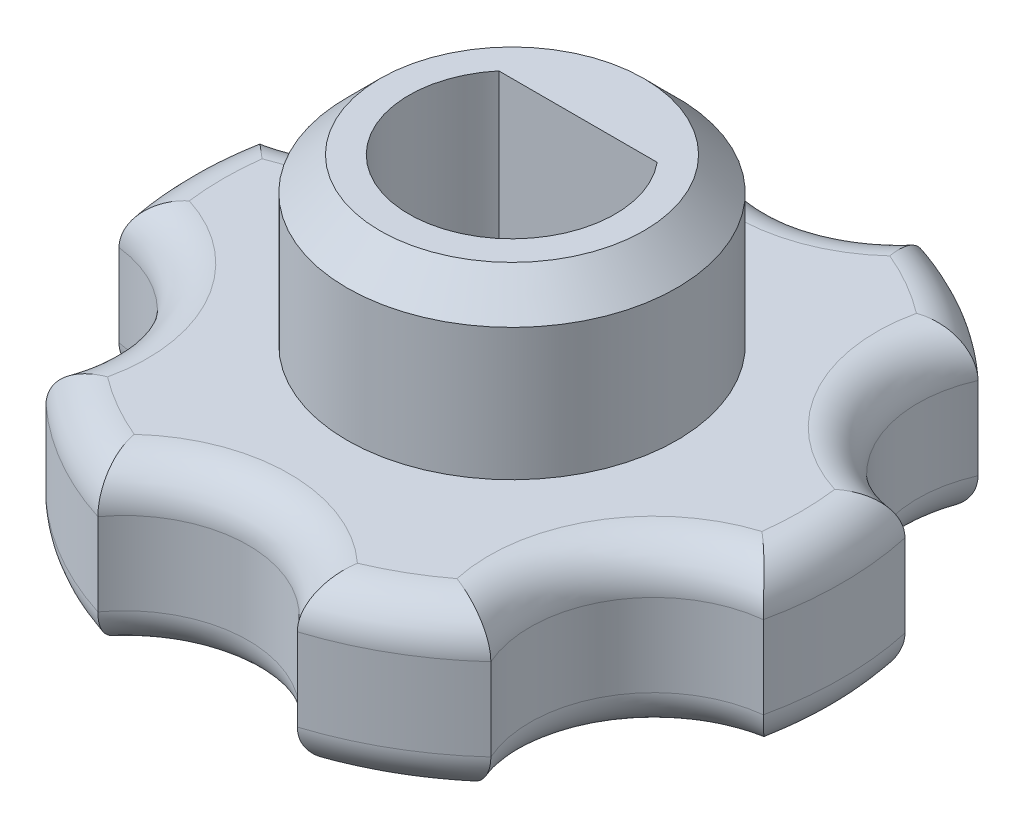
from build123d import *

# Parameters (mm, degrees)
BOSS_EXTRUDE1_DEPTH = 20
SKETCH4_R           = 20
BOSS_EXTRUDE2_DEPTH = 20
CUT_EXTRUDE1_DEPTH  = 20
FILLET1_R           = 5
CHAMFER1_SIZE       = 4


with BuildPart() as part:
    # Sketch3 → Boss-Extrude1 (new body)
    with BuildSketch(Plane(origin=(0, 0, 0), x_dir=(1, 0, 0), z_dir=(0, 1, 0))):
        with BuildLine():
            ThreePointArc((-39.066867795, 8.589519236), (-40, 0), (-39.066867795, -8.589519236))
            ThreePointArc((-39.066867795, -8.589519236), (-27.712812921, -16), (-26.972175762, -29.538140339))
            ThreePointArc((-26.972175762, -29.538140339), (-20, -34.641016151), (-12.094692033, -38.127659574))
            ThreePointArc((-12.094692033, -38.127659574), (0, -32), (12.094692033, -38.127659574))
            ThreePointArc((12.094692033, -38.127659574), (20, -34.641016151), (26.972175762, -29.538140339))
            ThreePointArc((26.972175762, -29.538140339), (27.712812921, -16), (39.066867795, -8.589519236))
            ThreePointArc((39.066867795, -8.589519236), (40, 0), (39.066867795, 8.589519236))
            ThreePointArc((39.066867795, 8.589519236), (27.712812921, 16), (26.972175762, 29.538140339))
            ThreePointArc((26.972175762, 29.538140339), (20, 34.641016151), (12.094692033, 38.127659574))
            ThreePointArc((12.094692033, 38.127659574), (0, 32), (-12.094692033, 38.127659574))
            ThreePointArc((-12.094692033, 38.127659574), (-20, 34.641016151), (-26.972175762, 29.538140339))
            ThreePointArc((-26.972175762, 29.538140339), (-27.712812921, 16), (-39.066867795, 8.589519236))
        make_face()
    extrude(amount=BOSS_EXTRUDE1_DEPTH)

    # Sketch4 → Boss-Extrude2 (add)
    with BuildSketch(Plane(origin=(0, 20, 0), x_dir=(1, 0, 0), z_dir=(0, 1, 0))):
        with Locations(Location((0, 0, 0), (0, 0, 270))):
            Circle(SKETCH4_R)
    extrude(amount=BOSS_EXTRUDE2_DEPTH)

    # Sketch5 → Cut-Extrude1 (cut)
    with BuildSketch(Plane(origin=(0, 40, 0), x_dir=(1, 0, 0), z_dir=(0, 1, 0))):
        with BuildLine():
            Line((-9.604686356, 8), (9.604686356, 8))
            ThreePointArc((9.604686356, 8), (0, -12.5), (-9.604686356, 8))
        make_face()
    extrude(amount=-CUT_EXTRUDE1_DEPTH, mode=Mode.SUBTRACT)

    # Fillet1
    fillet1_edges = [part.edges().sort_by_distance(p)[0] for p in [
        (0, 0, -32),
        (20, 0, -34.641016151),
        (-40, 20, 0),
        (27.712812921, 0, -16),
        (40, 0, 0),
        (27.712812921, 0, 16),
        (20, 0, 34.641016151),
        (0, 0, 32),
        (-20, 0, 34.641016151),
        (-27.712812921, 0, 16),
        (-40, 0, 0),
        (-27.712812921, 0, -16),
        (-20, 0, -34.641016151),
        (-27.712812921, 20, 16),
        (-20, 20, 34.641016151),
        (0, 20, 32),
        (20, 20, 34.641016151),
        (27.712812921, 20, 16),
        (40, 20, 0),
        (27.712812921, 20, -16),
        (20, 20, -34.641016151),
        (0, 20, -32),
        (-20, 20, -34.641016151),
        (-27.712812921, 20, -16),
    ]]
    fillet(fillet1_edges, radius=FILLET1_R)

    # Chamfer1
    chamfer1_edges = [part.edges().sort_by_distance(p)[0] for p in [
        (0, 40, -20),
    ]]
    chamfer(chamfer1_edges, length=CHAMFER1_SIZE)


solid = part.part
